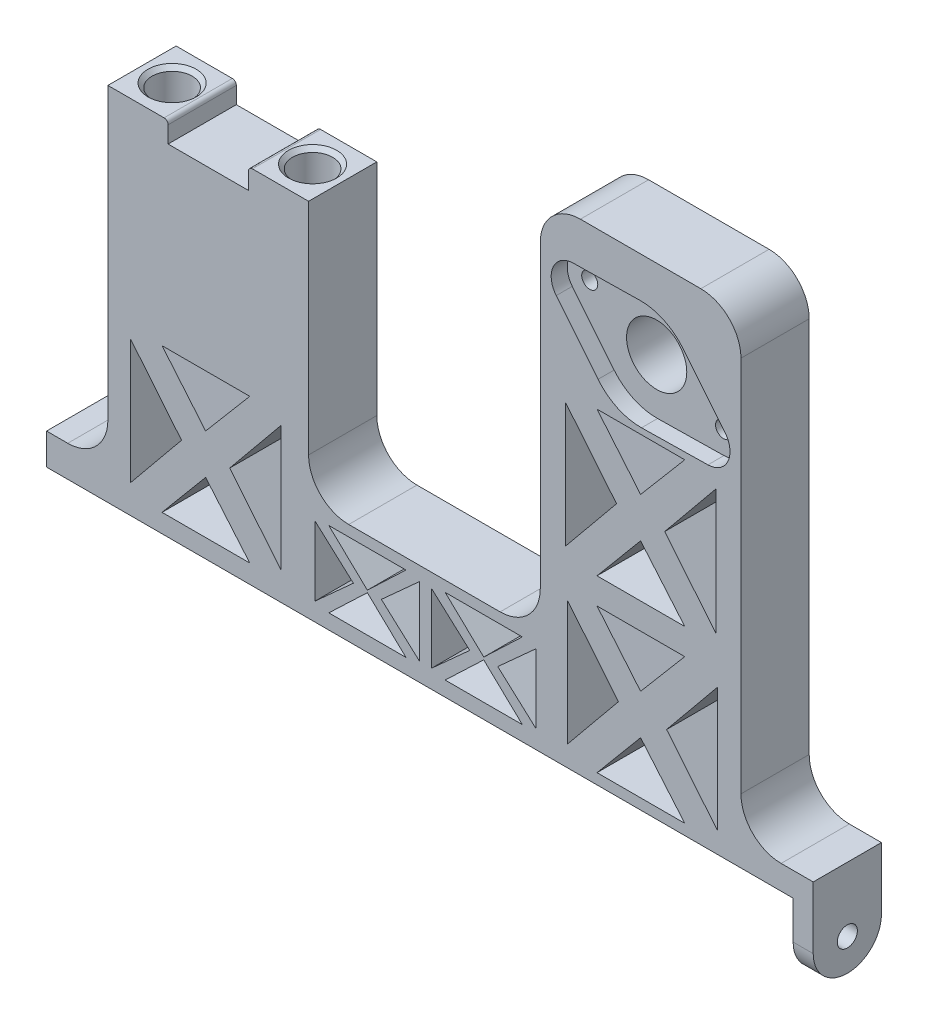
from build123d import *

# Parameters (mm, degrees)
CROQUIS1_R              = 7.5
SALIENTE_EXTRUIR1_DEPTH = 17
REDONDEO1_R             = 10
REDONDEO2_R             = 10
REDONDEO8_R             = 10
REDONDEO9_R             = 10
REDONDEO11_R            = 10
REDONDEO12_R            = 10
SALIENTE_EXTRUIR2_DEPTH = 186
CROQUIS5_R              = 2.5
SALIENTE_EXTRUIR6_DEPTH = 5
CORTAR_EXTRUIR5_DEPTH   = 4
SKETCH3_R               = 2
CUT_EXTRUDE1_DEPTH      = 156.476686355
SKETCH4_R               = 5
CUT_EXTRUDE2_DEPTH      = 17.5
FILLET1_R               = 1
CHAMFER1_SIZE           = 1


with BuildPart() as part:
    # Croquis1 → Saliente-Extruir1 (new body)
    with BuildSketch(Plane.XY):
        Polygon((-93, 0), (93, 0), (93, 6), (80, 6), (80, 120), (30, 120), (30, 25.267194249), (-27.720969348, 25.267194249), (-27.720969348, 90), (-42.720969348, 90), (-42.720969348, 84.845258293), (-62.720969348, 84.845258293), (-62.720969348, 90), (-77.720969348, 90), (-77.720969348, 7.786589187), (-93, 7.786589187), align=None)
        Polygon((-53.370368055, 17.608830496), (-42.369998576, 4.626570416), (-64.231453048, 4.626570416), align=None, mode=Mode.SUBTRACT)
        Polygon((-72.099249791, 38.14298816), (-59.370368055, 22.608830496), (-72.099249791, 7.074672833), align=None, mode=Mode.SUBTRACT)
        Polygon((-3.458697993, 3.711831174), (-22.689998763, 3.711831174), (-13.074348378, 12.870825965), align=None, mode=Mode.SUBTRACT)
        Polygon((-26.085940215, 4.558933089), (-26.085940215, 21.785882097), (-16.561331103, 13.172407593), align=None, mode=Mode.SUBTRACT)
        Polygon((-9.587365653, 13.172407593), (-0.062756541, 21.785882097), (-0.062756541, 4.558933089), align=None, mode=Mode.SUBTRACT)
        Polygon((-34.641486319, 7.074672833), (-47.370368055, 22.608830496), (-34.641486319, 38.14298816), align=None, mode=Mode.SUBTRACT)
        Polygon((-13.074348378, 13.411373354), (-22.689998763, 22.570368145), (-3.458697993, 22.570368145), align=None, mode=Mode.SUBTRACT)
        Polygon((-53.370368055, 27.608830496), (-64.231453048, 40.591090577), (-42.369998576, 40.591090577), align=None, mode=Mode.SUBTRACT)
        Polygon((2.908210147, 4.558933089), (2.908210147, 21.785882097), (12.432819259, 13.172407593), align=None, mode=Mode.SUBTRACT)
        Polygon((6.304151599, 3.711831174), (15.919801984, 12.870825965), (25.535452369, 3.711831174), align=None, mode=Mode.SUBTRACT)
        Polygon((28.931393821, 21.785882097), (28.931393821, 4.558933089), (19.406784708, 13.172407593), align=None, mode=Mode.SUBTRACT)
        Polygon((6.304151599, 22.632984011), (25.535452369, 22.632984011), (15.919801984, 13.47398922), align=None, mode=Mode.SUBTRACT)
        Polygon((36.750632631, 36.163668304), (49.479514367, 20.629510641), (36.750632631, 5.095352977), align=None, mode=Mode.SUBTRACT)
        Polygon((55, 15.629510641), (66.000369479, 2.64725056), (44.138915007, 2.64725056), align=None, mode=Mode.SUBTRACT)
        Polygon((74.208396103, 5.095352977), (61.479514367, 20.629510641), (74.208396103, 36.163668304), align=None, mode=Mode.SUBTRACT)
        Polygon((55, 25.629510641), (44.138915007, 38.611770721), (66.000369479, 38.611770721), align=None, mode=Mode.SUBTRACT)
        Polygon((55, 58.101191757), (66.000369479, 45.118931676), (44.138915007, 45.118931676), align=None, mode=Mode.SUBTRACT)
        Polygon((36.271118264, 78.63534942), (49, 63.101191757), (36.271118264, 47.567034093), align=None, mode=Mode.SUBTRACT)
        Polygon((73.728881736, 47.567034093), (61, 63.101191757), (73.728881736, 78.63534942), align=None, mode=Mode.SUBTRACT)
        Polygon((55, 68.101191757), (44.138915007, 81.083451837), (66.000369479, 81.083451837), align=None, mode=Mode.SUBTRACT)
        with Locations((55, 96.25)):
            Circle(CROQUIS1_R, mode=Mode.SUBTRACT)
    extrude(amount=SALIENTE_EXTRUIR1_DEPTH)

    # Redondeo1
    redondeo1_edges = [part.edges().sort_by_distance(p)[0] for p in [
        (80, 120, 8.5),
    ]]
    fillet(redondeo1_edges, radius=REDONDEO1_R)

    # Redondeo2
    redondeo2_edges = [part.edges().sort_by_distance(p)[0] for p in [
        (30, 120, 8.5),
    ]]
    fillet(redondeo2_edges, radius=REDONDEO2_R)

    # Redondeo8
    redondeo8_edges = [part.edges().sort_by_distance(p)[0] for p in [
        (30, 25.267194249, 8.5),
    ]]
    fillet(redondeo8_edges, radius=REDONDEO8_R)

    # Redondeo9
    redondeo9_edges = [part.edges().sort_by_distance(p)[0] for p in [
        (-27.720969348, 25.267194249, 8.5),
    ]]
    fillet(redondeo9_edges, radius=REDONDEO9_R)

    # Redondeo11
    redondeo11_edges = [part.edges().sort_by_distance(p)[0] for p in [
        (80, 6, 8.5),
    ]]
    fillet(redondeo11_edges, radius=REDONDEO11_R)

    # Redondeo12
    redondeo12_edges = [part.edges().sort_by_distance(p)[0] for p in [
        (-77.720969348, 7.786589187, 8.5),
    ]]
    fillet(redondeo12_edges, radius=REDONDEO12_R)

    # Croquis4 → Saliente-Extruir2 (add)
    with BuildSketch(Plane.ZY.offset(93)):
        with BuildLine():
            Line((5.614135824, 0), (5.614135824, -2.2))
            Line((5.614135824, -2.2), (3.414135824, -2.2))
            Line((3.414135824, -2.2), (3.414135824, -3.7))
            Line((3.414135824, -3.7), (4.862457658, -5.028042266))
            ThreePointArc((4.862457658, -5.028042266), (5.488945101, -5.4178372), (6.214135824, -5.553943851))
            Line((6.214135824, -5.553943851), (10.014135824, -5.553943851))
            ThreePointArc((10.014135824, -5.553943851), (10.739326546, -5.4178372), (11.365813989, -5.028042266))
            Line((11.365813989, -5.028042266), (12.814135824, -3.7))
            Line((12.814135824, -3.7), (12.814135824, -2.2))
            Line((12.814135824, -2.2), (10.614135824, -2.2))
            Line((10.614135824, -2.2), (10.614135824, 0))
            Line((10.614135824, 0), (5.614135824, 0))
        make_face()
    extrude(amount=-SALIENTE_EXTRUIR2_DEPTH)

    # Croquis5 → Saliente-Extruir6 (add)
    with BuildSketch(Plane(origin=(93, 0, 0), x_dir=(0, 0, -1), z_dir=(1, 0, 0))):
        with BuildLine():
            Line((-17, 6), (0, 6))
            Line((0, 6), (0, 0))
            Line((0, 0), (0, -9.475176398))
            ThreePointArc((0, -9.475176398), (-8.5, -17.975176398), (-17, -9.475176398))
            Line((-17, -9.475176398), (-17, 0))
            Line((-17, 0), (-17, 6))
        make_face()
        with Locations((-8.5, -10)):
            Circle(CROQUIS5_R, mode=Mode.SUBTRACT)
    extrude(amount=SALIENTE_EXTRUIR6_DEPTH)

    # Croquis13 → Cortar-Extruir5 (cut)
    with BuildSketch(Plane.XY.offset(17)):
        with BuildLine():
            Line((55.225000256, 82.601854526), (71.768371079, 82.874584815))
            ThreePointArc((71.768371079, 82.874584815), (76.751386889, 86.107161718), (76.024663641, 92.00223367))
            Line((76.024663641, 92.00223367), (65.599713376, 104.850498611))
            ThreePointArc((65.599713376, 104.850498611), (60.870506535, 108.57313487), (55, 109.9))
            ThreePointArc((55, 109.9), (54.887496051, 109.899536361), (54.774999744, 109.898145474))
            Line((54.774999744, 109.898145474), (38.231628921, 109.625415185))
            ThreePointArc((38.231628921, 109.625415185), (33.248613111, 106.392838282), (33.975336359, 100.49776633))
            Line((33.975336359, 100.49776633), (44.400286624, 87.649501389))
            ThreePointArc((44.400286624, 87.649501389), (49.231260727, 83.878898707), (55.225000256, 82.601854526))
        make_face()
    extrude(amount=-CORTAR_EXTRUIR5_DEPTH, mode=Mode.SUBTRACT)

    # Sketch3 → Cut-Extrude1 (cut, through all)
    with BuildSketch(Plane.XY.offset(13)):
        with Locations((38.323936719, 104.02617602)):
            Circle(SKETCH3_R)
        with Locations((71.676063281, 88.47382398)):
            Circle(SKETCH3_R)
    extrude(amount=-CUT_EXTRUDE1_DEPTH, mode=Mode.SUBTRACT)

    # Sketch4 → Cut-Extrude2 (cut)
    with BuildSketch(Plane(origin=(0, 90, 0), x_dir=(1, 0, 0), z_dir=(0, 1, 0))):
        with Locations((-70.220969348, -8.5)):
            Circle(SKETCH4_R)
        with Locations((-35.220969348, -8.5)):
            Circle(SKETCH4_R)
    extrude(amount=-CUT_EXTRUDE2_DEPTH, mode=Mode.SUBTRACT)

    # Fillet1
    fillet1_edges = [part.edges().sort_by_distance(p)[0] for p in [
        (-42.720969348, 90, 8.5),
        (-62.720969348, 90, 8.5),
    ]]
    fillet(fillet1_edges, radius=FILLET1_R)

    # Chamfer1
    chamfer1_edges = [part.edges().sort_by_distance(p)[0] for p in [
        (-40.220969348, 90, 8.5),
        (-75.220969348, 90, 8.5),
    ]]
    chamfer(chamfer1_edges, length=CHAMFER1_SIZE)


solid = part.part
